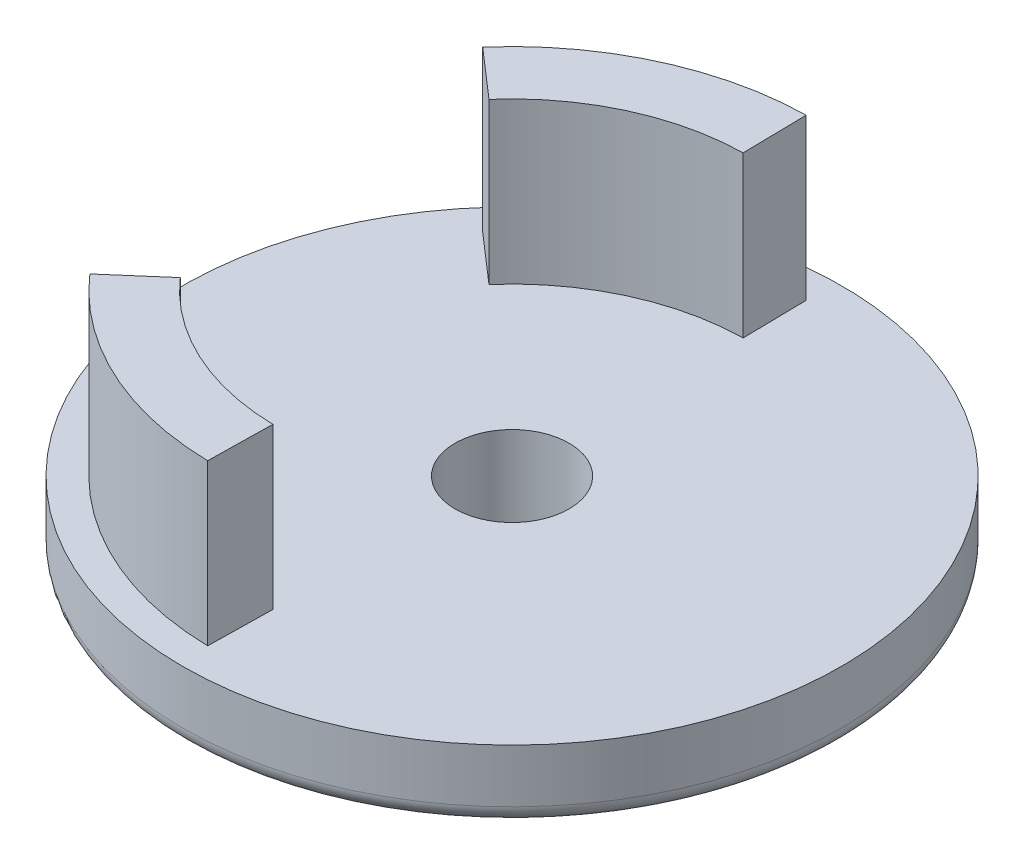
from build123d import *

# Parameters (mm, degrees)
SKETCH1_R           = 18.5
BOSS_EXTRUDE1_DEPTH = 4
SKETCH3_R           = 4
BOSS_EXTRUDE2_DEPTH = 10
FILLET1_R           = 1
FILLET2_R           = 1
BOSS_EXTRUDE3_DEPTH = 9
SKETCH5_R           = 3.2
CUT_EXTRUDE1_DEPTH  = 30.673220359


with BuildPart() as part:
    # Sketch1 → Boss-Extrude1 (new body)
    with BuildSketch(Plane(origin=(0, 0, 0), x_dir=(1, 0, 0), z_dir=(0, 1, 0))):
        Circle(SKETCH1_R)
    extrude(amount=BOSS_EXTRUDE1_DEPTH)

    # Sketch3 → Boss-Extrude2 (add)
    with BuildSketch(Plane.XZ):
        Circle(SKETCH3_R)
    extrude(amount=BOSS_EXTRUDE2_DEPTH)

    # Fillet1
    fillet1_edges = [part.edges().sort_by_distance(p)[0] for p in [
        (-4, -10, 0),
    ]]
    fillet(fillet1_edges, radius=FILLET1_R)

    # Fillet2
    fillet2_edges = [part.edges().sort_by_distance(p)[0] for p in [
        (-18.5, 0, 0),
        (-4, 0, 0),
    ]]
    fillet(fillet2_edges, radius=FILLET2_R)

    # Sketch4 → Boss-Extrude3 (add)
    with BuildSketch(Plane(origin=(0, 4, 0), x_dir=(1, 0, 0), z_dir=(0, 1, 0))):
        with BuildLine():
            Line((-12.675055994, 11.02646614), (-9.958972567, 8.663651967))
            ThreePointArc((-9.958972567, 8.663651967), (-5.574490656, 11.965160004), (-0.226257983, 13.198060741))
            Line((-0.226257983, 13.198060741), (-0.287964706, 16.797531852))
            ThreePointArc((-0.287964706, 16.797531852), (-7.094806289, 15.22838546), (-12.675055994, 11.02646614))
        make_face()
        with BuildLine():
            Line((-9.958972567, -8.663651967), (-12.675055994, -11.02646614))
            ThreePointArc((-12.675055994, -11.02646614), (-7.094806289, -15.22838546), (-0.287964706, -16.797531852))
            Line((-0.287964706, -16.797531852), (-0.226257983, -13.198060741))
            ThreePointArc((-0.226257983, -13.198060741), (-5.574490656, -11.965160004), (-9.958972567, -8.663651967))
        make_face()
    extrude(amount=BOSS_EXTRUDE3_DEPTH)

    # Sketch5 → Cut-Extrude1 (cut, through all)
    with BuildSketch(Plane(origin=(0, 4, 0), x_dir=(1, 0, 0), z_dir=(0, 1, 0))):
        Circle(SKETCH5_R)
    extrude(amount=-CUT_EXTRUDE1_DEPTH, mode=Mode.SUBTRACT)


solid = part.part
